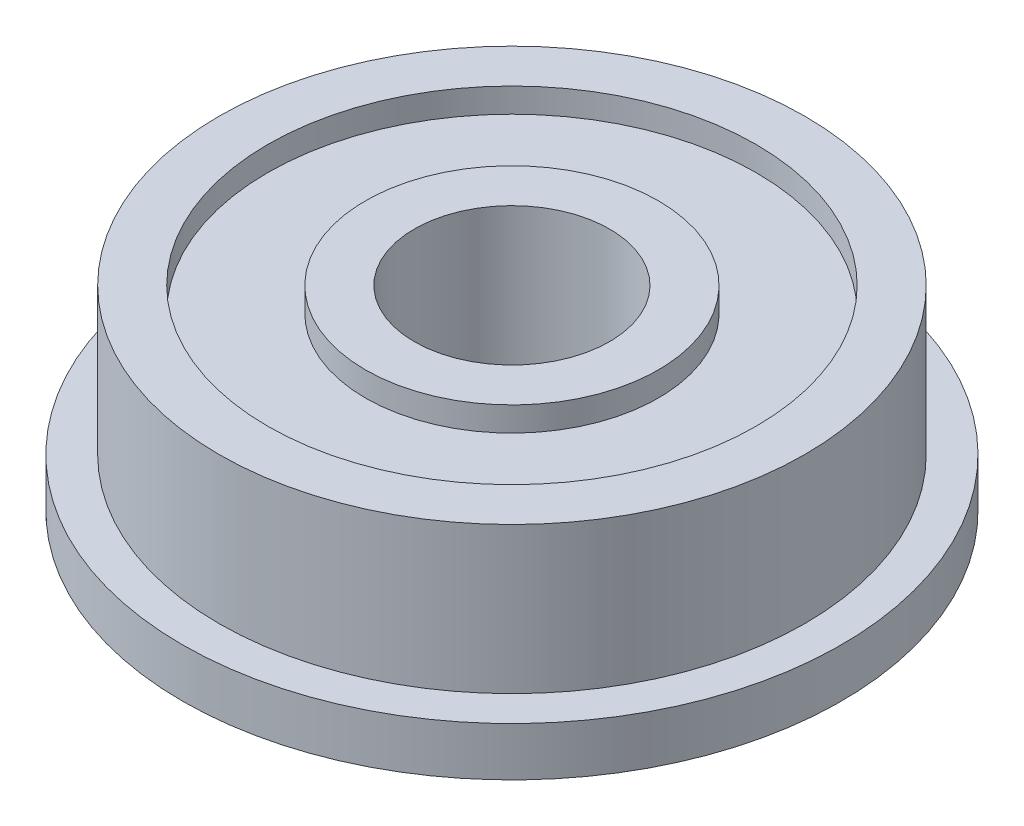
from build123d import *

# Parameters (mm, degrees)
SKETCH_1_R          = 6000
SKETCH_1_R_2        = 2000
EXTRUDE_1_DEPTH     = 4000
SKETCH_1_3_R        = 6750
SKETCH_1_3_R_2      = 6000
EXTRUDE_2_DEPTH     = 1000
SKETCH_2_R          = 5000
SKETCH_2_R_2        = 3000
CUT_EXTRUDE_1_DEPTH = 500


with BuildPart() as part:
    # 草圖1 → 填料-伸長1 (new body)
    with BuildSketch(Plane(origin=(0, 0, 0), x_dir=(1, 0, 0), z_dir=(0, 1, 0))):
        Circle(SKETCH_1_R)
        Circle(SKETCH_1_R_2, mode=Mode.SUBTRACT)
    extrude(amount=EXTRUDE_1_DEPTH)

    # 草圖1<3> → 填料-伸長2 (add)
    with BuildSketch(Plane(origin=(0, 0, 0), x_dir=(1, 0, 0), z_dir=(0, 1, 0))):
        Circle(SKETCH_1_3_R)
        Circle(SKETCH_1_3_R_2, mode=Mode.SUBTRACT)
    extrude(amount=EXTRUDE_2_DEPTH)

    # 草圖2 → 除料-伸長1 (cut)
    with BuildSketch(Plane(origin=(0, 4000, 0), x_dir=(1, 0, 0), z_dir=(0, 1, 0))):
        Circle(SKETCH_2_R)
        Circle(SKETCH_2_R_2, mode=Mode.SUBTRACT)
    extrude(amount=-CUT_EXTRUDE_1_DEPTH, mode=Mode.SUBTRACT)


solid = part.part
